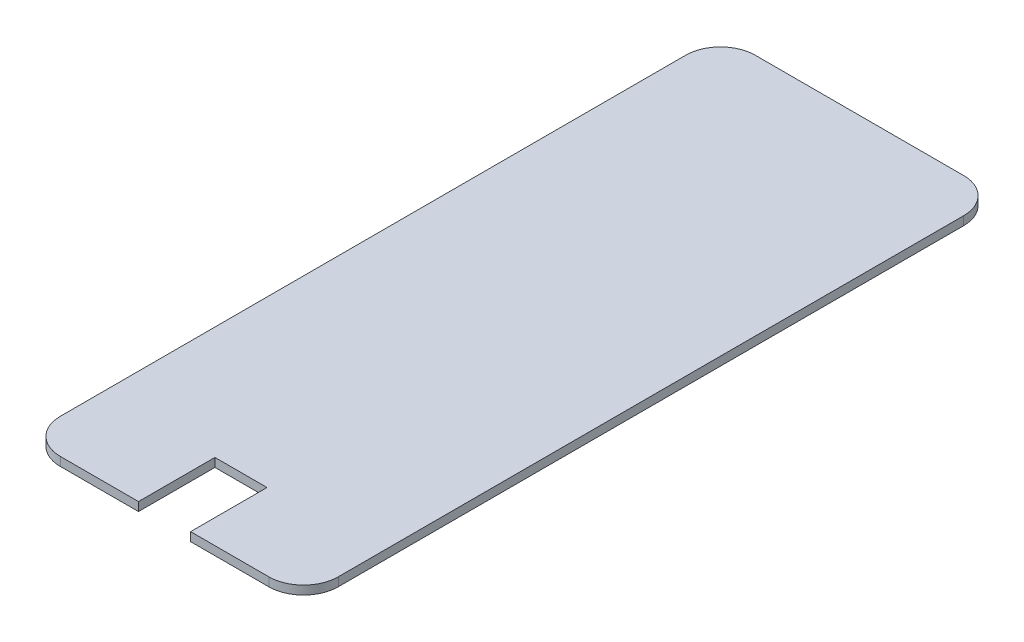
from build123d import *

# Parameters (mm, degrees)
SKETCH1_W           = 101.6
SKETCH1_H           = 254
BOSS_EXTRUDE1_DEPTH = 3.175
FILLET1_R           = 12.7
SKETCH2_W           = 19.05
SKETCH2_H           = 27.94
CUT_EXTRUDE1_DEPTH  = 137.820030058


with BuildPart() as part:
    # Sketch1 → Boss-Extrude1 (new body)
    with BuildSketch(Plane(origin=(0, 0, 0), x_dir=(1, 0, 0), z_dir=(0, 1, 0))):
        Rectangle(SKETCH1_W, SKETCH1_H)
    extrude(amount=BOSS_EXTRUDE1_DEPTH)

    # Fillet1
    fillet1_edges = [part.edges().sort_by_distance(p)[0] for p in [
        (-50.8, 1.5875, 127),
        (50.8, 1.5875, 127),
        (50.8, 1.5875, -127),
        (-50.8, 1.5875, -127),
    ]]
    fillet(fillet1_edges, radius=FILLET1_R)

    # Sketch2 → Cut-Extrude1 (cut, through all)
    with BuildSketch(Plane(origin=(0, 3.175, 0), x_dir=(1, 0, 0), z_dir=(0, 1, 0))):
        with Locations((0, -113.03)):
            Rectangle(SKETCH2_W, SKETCH2_H)
    extrude(amount=-CUT_EXTRUDE1_DEPTH, mode=Mode.SUBTRACT)


solid = part.part
